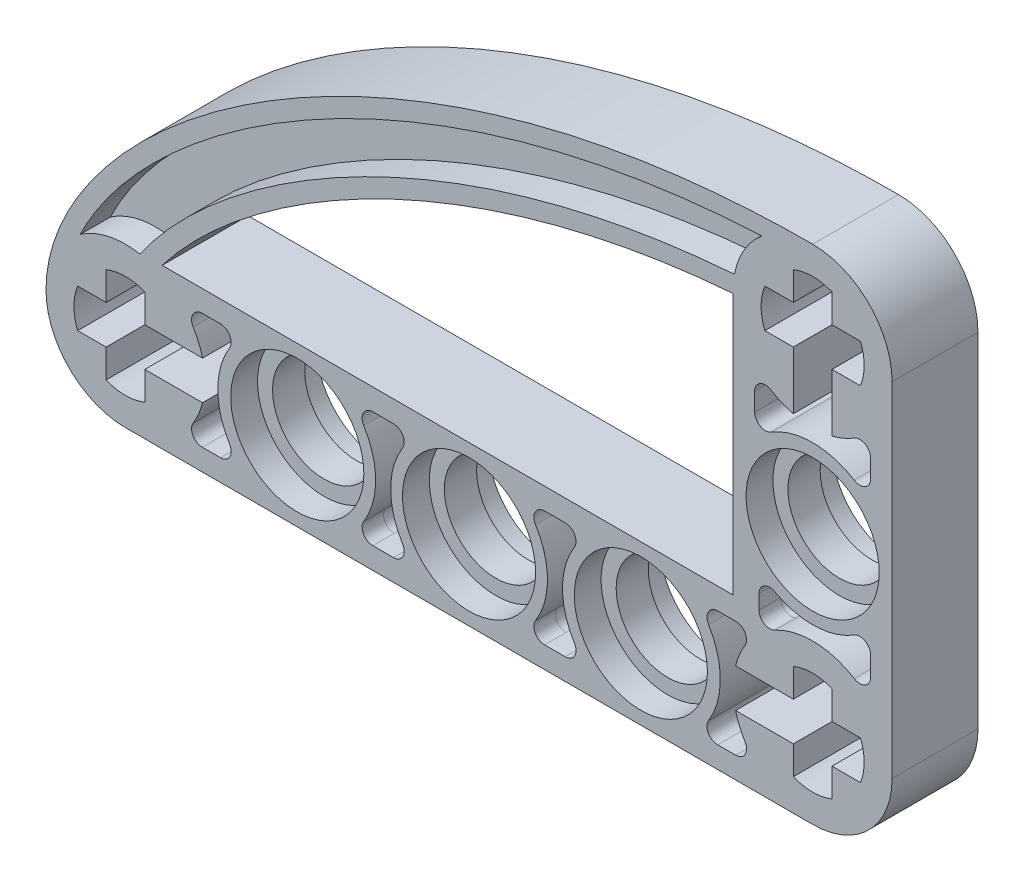
from build123d import *

# Parameters (mm, degrees)
SKETCH1_R            = 2.4
BEAM_DEPTH           = 2
AXLE_CUT_DEPTH       = 41.823767587
AXLE_CUT_DEPTH_BACK  = 41.823767587
SKETCH3_R            = 3.1
HOLE_SURROUND_DEPTH  = 1.25
CAVITY_START         = -3
CAVITY_CUT_DEPTH     = 3
FILLET2_R            = 0.5
CURVE_DEPTH          = 2
CURVE_START          = -1.4
CURVE_CUT_DEPTH      = 1.4
FILLET2_OF_MIRROR2_R = 0.5
FILLET3_R            = 0.5


with BuildPart() as part:
    # Sketch1 → Beam (new, symmetric)
    with BuildSketch(Plane.XY):
        with BuildLine():
            Line((28.3, 3.7), (0, 3.7))
            ThreePointArc((0, 3.7), (-3.7, 0), (0, -3.7))
            Line((0, -3.7), (32, -3.7))
            ThreePointArc((32, -3.7), (34.61629509, -2.61629509), (35.7, 0))
            Line((35.7, 0), (35.7, 16))
            ThreePointArc((35.7, 16), (32, 19.7), (28.3, 16))
            Line((28.3, 16), (28.3, 3.7))
        make_face()
        with Locations((8, 0)):
            Circle(SKETCH1_R, mode=Mode.SUBTRACT)
        with Locations((16, 0)):
            Circle(SKETCH1_R, mode=Mode.SUBTRACT)
        with Locations((24, 0)):
            Circle(SKETCH1_R, mode=Mode.SUBTRACT)
        with Locations((32, 8)):
            Circle(SKETCH1_R, mode=Mode.SUBTRACT)
    extrude(amount=BEAM_DEPTH, both=True)

    # Sketch2 → Axle Cut (cut, two sides: drawn at the far end of the back side and taken through both)
    with BuildSketch(Plane.XY.offset(-AXLE_CUT_DEPTH_BACK)):
        with BuildLine():
            ThreePointArc((-0.9, -2.224859546), (0, -2.4), (0.9, -2.224859546))
            Line((0.9, -2.224859546), (0.9, -0.9))
            Line((0.9, -0.9), (3.588871689, -0.9))
            ThreePointArc((3.588871689, -0.9), (3.188981578, -1.876271967), (2.529822128, -2.7))
            Line((2.529822128, -2.7), (5.470177872, -2.7))
            ThreePointArc((5.470177872, -2.7), (4.3, 0), (5.470177872, 2.7))
            Line((5.470177872, 2.7), (2.529822128, 2.7))
            ThreePointArc((2.529822128, 2.7), (3.188981578, 1.876271967), (3.588871689, 0.9))
            Line((3.588871689, 0.9), (0.9, 0.9))
            Line((0.9, 0.9), (0.9, 2.224859546))
            ThreePointArc((0.9, 2.224859546), (0, 2.4), (-0.9, 2.224859546))
            Line((-0.9, 2.224859546), (-0.9, 0.9))
            Line((-0.9, 0.9), (-2.224859546, 0.9))
            ThreePointArc((-2.224859546, 0.9), (-2.4, 0), (-2.224859546, -0.9))
            Line((-2.224859546, -0.9), (-0.9, -0.9))
            Line((-0.9, -0.9), (-0.9, -2.224859546))
        make_face()
        with BuildLine():
            Line((26.529822128, -2.7), (29.470177872, -2.7))
            ThreePointArc((29.470177872, -2.7), (28.811018422, -1.876271967), (28.411128311, -0.9))
            Line((28.411128311, -0.9), (31.1, -0.9))
            Line((31.1, -0.9), (31.1, -2.224859546))
            ThreePointArc((31.1, -2.224859546), (32, -2.4), (32.9, -2.224859546))
            Line((32.9, -2.224859546), (32.9, -0.9))
            Line((32.9, -0.9), (34.224859546, -0.9))
            ThreePointArc((34.224859546, -0.9), (34.4, 0), (34.224859546, 0.9))
            Line((34.224859546, 0.9), (32.9, 0.9))
            Line((32.9, 0.9), (32.9, 2.224859546))
            ThreePointArc((32.9, 2.224859546), (32, 2.4), (31.1, 2.224859546))
            Line((31.1, 2.224859546), (31.1, 0.9))
            Line((31.1, 0.9), (28.411128311, 0.9))
            ThreePointArc((28.411128311, 0.9), (28.811018422, 1.876271967), (29.470177872, 2.7))
            Line((29.470177872, 2.7), (26.529822128, 2.7))
            ThreePointArc((26.529822128, 2.7), (27.7, 0), (26.529822128, -2.7))
        make_face()
        with BuildLine():
            ThreePointArc((29.3, 10.529822128), (32, 11.7), (34.7, 10.529822128))
            Line((34.7, 10.529822128), (34.7, 13.470177872))
            ThreePointArc((34.7, 13.470177872), (33.876271967, 12.811018422), (32.9, 12.411128311))
            Line((32.9, 12.411128311), (32.9, 15.1))
            Line((32.9, 15.1), (34.224859546, 15.1))
            ThreePointArc((34.224859546, 15.1), (34.4, 16), (34.224859546, 16.9))
            Line((34.224859546, 16.9), (32.9, 16.9))
            Line((32.9, 16.9), (32.9, 18.224859546))
            ThreePointArc((32.9, 18.224859546), (32, 18.4), (31.1, 18.224859546))
            Line((31.1, 18.224859546), (31.1, 16.9))
            Line((31.1, 16.9), (29.775140454, 16.9))
            ThreePointArc((29.775140454, 16.9), (29.6, 16), (29.775140454, 15.1))
            Line((29.775140454, 15.1), (31.1, 15.1))
            Line((31.1, 15.1), (31.1, 12.411128311))
            ThreePointArc((31.1, 12.411128311), (30.123728033, 12.811018422), (29.3, 13.470177872))
            Line((29.3, 13.470177872), (29.3, 10.529822128))
        make_face()
    extrude(amount=AXLE_CUT_DEPTH + AXLE_CUT_DEPTH_BACK, mode=Mode.SUBTRACT)

    # Sketch3 → Hole Surround (cut)
    with BuildSketch(Plane.XY.offset(2)):
        with Locations((32, 8)):
            Circle(SKETCH3_R)
        with Locations((24, 0)):
            Circle(SKETCH3_R)
        with Locations((16, 0)):
            Circle(SKETCH3_R)
        with Locations((8, 0)):
            Circle(SKETCH3_R)
    hole_surround = extrude(amount=-HOLE_SURROUND_DEPTH, mode=Mode.SUBTRACT)

    # Sketch4 → Cavity Cut (cut)
    with BuildSketch(Plane.XY.offset(2).offset(CAVITY_START)):
        with BuildLine():
            ThreePointArc((29.5, 2.727636339), (32.140650686, 3.697325707), (34.7, 2.529822128))
            Line((34.7, 2.529822128), (34.7, 5.543885182))
            ThreePointArc((34.7, 5.543885182), (32.142593715, 4.352786402), (29.5, 5.340582771))
            Line((29.5, 5.340582771), (29.5, 2.727636339))
        make_face()
        with BuildLine():
            Line((13.543885182, 2.7), (10.456114818, 2.7))
            ThreePointArc((10.456114818, 2.7), (11.65, 0), (10.456114818, -2.7))
            Line((10.456114818, -2.7), (13.543885182, -2.7))
            ThreePointArc((13.543885182, -2.7), (12.35, 0), (13.543885182, 2.7))
        make_face()
        with BuildLine():
            Line((21.543885182, 2.7), (18.456114818, 2.7))
            ThreePointArc((18.456114818, 2.7), (19.65, 0), (18.456114818, -2.7))
            Line((18.456114818, -2.7), (21.543885182, -2.7))
            ThreePointArc((21.543885182, -2.7), (20.35, 0), (21.543885182, 2.7))
        make_face()
    cavity_cut = extrude(amount=CAVITY_CUT_DEPTH, mode=Mode.SUBTRACT)

    # Fillet2
    fillet2_edges = [part.edges().sort_by_distance(p)[0] for p in [
        (29.5, 2.727636339, 0.5),
        (34.7, 5.543885182, 0.5),
        (29.5, 5.340582771, 0.5),
        (34.7, 2.529822128, 0.5),
        (21.543885182, 2.7, 0.5),
        (18.456114818, 2.7, 0.5),
        (18.456114818, -2.7, 0.5),
        (21.543885182, -2.7, 0.5),
        (13.543885182, 2.7, 0.5),
        (10.456114818, 2.7, 0.5),
        (10.456114818, -2.7, 0.5),
        (13.543885182, -2.7, 0.5),
    ]]
    fillet(fillet2_edges, radius=FILLET2_R)

    # Sketch5 → Curve (add, symmetric)
    with BuildSketch(Plane.XY):
        with BuildLine():
            add(Edge.make_bspline(
                [(1.706246848, 3.7), (1.758938435, 3.769365387), (2.496345175, 4.722899373), (4.372863444, 6.693759611), (8.184040286, 9.537809687), (12.965250409, 12.123168449), (17.6529079, 13.875554501), (21.766594544, 14.934372338), (24.971860901, 15.523866587), (27.193605966, 15.773559555), (28.3, 15.858576902)],
                knots=[0.24013078, 0.24013078, 0.24013078, 0.24013078, 0.25, 0.375, 0.5, 0.625, 0.75, 0.8125, 0.875, 0.934776474, 0.934776474, 0.934776474, 0.934776474], degree=3))
            Line((28.3, 15.858576902), (28.3, 16))
            ThreePointArc((28.3, 16), (29.38370491, 18.61629509), (32, 19.7))
            add(Edge.make_bspline(
                [(-3.7, 0), (-3.7, 7.393466037), (11.251254247, 19.7), (32, 19.7)],
                knots=[0, 0, 0, 0, 1, 1, 1, 1], degree=3))
            ThreePointArc((-3.7, 0), (-2.61629509, 2.61629509), (0, 3.7))
            Line((0, 3.7), (1.706246848, 3.7))
        make_face()
    extrude(amount=CURVE_DEPTH, both=True)

    # Sketch6 → Curve Cut (cut)
    with BuildSketch(Plane.XY.offset(2).offset(CURVE_START)):
        with BuildLine():
            add(Edge.make_bspline(
                [(0.673860815, 3.63811924), (1.661054708, 5.072072507), (3.169973765, 6.663304905), (6.836664079, 9.5509506), (8.887639955, 10.862030116), (13.55854427, 13.204038342), (16.178410206, 14.235483078), (20.457193549, 15.435776625), (21.941384435, 15.778151997), (25.052613269, 16.332398206), (26.683669446, 16.540797816), (28.360327083, 16.665417956)],
                knots=[-0.035795542, -0.035795542, -0.035795542, -0.035795542, 0.25, 0.25, 0.5, 0.5, 0.75, 0.75, 0.875, 0.875, 1.003099362, 1.003099362, 1.003099362, 1.003099362], degree=3))
            ThreePointArc((28.360327083, 16.665417956), (28.805984549, 17.867689829), (29.635219761, 18.845665901))
            add(Edge.make_bspline(
                [(-2.104364114, 3.043296186), (-1.69522286, 3.894854742), (-1.128045364, 4.791190868), (1.244207299, 7.806119487), (3.696084182, 9.987059348), (9.897055814, 13.905454106), (13.645295328, 15.645555249), (21.479714103, 17.947669251), (25.42176771, 18.651610326), (29.635219761, 18.845665901)],
                knots=[0.141688876, 0.141688876, 0.141688876, 0.141688876, 0.25, 0.25, 0.5, 0.5, 0.75, 0.75, 0.960984416, 0.960984416, 0.960984416, 0.960984416], degree=3))
            ThreePointArc((-2.104364114, 3.043296186), (-0.774621545, 3.618005177), (0.673860815, 3.63811924))
        make_face()
    curve_cut = extrude(amount=CURVE_CUT_DEPTH, mode=Mode.SUBTRACT)

    # Mirror2: Hole Surround, Cavity Cut, Curve Cut across plane
    add(hole_surround.mirror(Plane.XY), mode=Mode.SUBTRACT)
    add(cavity_cut.mirror(Plane.XY), mode=Mode.SUBTRACT)
    add(curve_cut.mirror(Plane.XY), mode=Mode.SUBTRACT)

    # Fillet2 of Mirror2
    fillet2_of_mirror2_edges = [part.edges().sort_by_distance(p)[0] for p in [
        (29.5, 2.727636339, -0.5),
        (34.7, 5.543885182, -0.5),
        (29.5, 5.340582771, -0.5),
        (34.7, 2.529822128, -0.5),
        (21.543885182, 2.7, -0.5),
        (18.456114818, 2.7, -0.5),
        (18.456114818, -2.7, -0.5),
        (21.543885182, -2.7, -0.5),
        (13.543885182, 2.7, -0.5),
        (10.456114818, 2.7, -0.5),
        (10.456114818, -2.7, -0.5),
        (13.543885182, -2.7, -0.5),
    ]]
    fillet(fillet2_of_mirror2_edges, radius=FILLET2_OF_MIRROR2_R)

    # Fillet3
    fillet3_edges = [part.edges().sort_by_distance(p)[0] for p in [
        (2.529822128, -2.7, 0),
        (5.470177872, -2.7, 0),
        (5.470177872, 2.7, 0),
        (2.529822128, 2.7, 0),
        (29.3, 13.470177872, 0),
        (29.3, 10.529822128, 0),
        (34.7, 10.529822128, 0),
        (34.7, 13.470177872, 0),
        (29.470177872, 2.7, 0),
        (29.470177872, -2.7, 0),
        (26.529822128, -2.7, 0),
        (26.529822128, 2.7, 0),
    ]]
    fillet(fillet3_edges, radius=FILLET3_R)


solid = part.part
